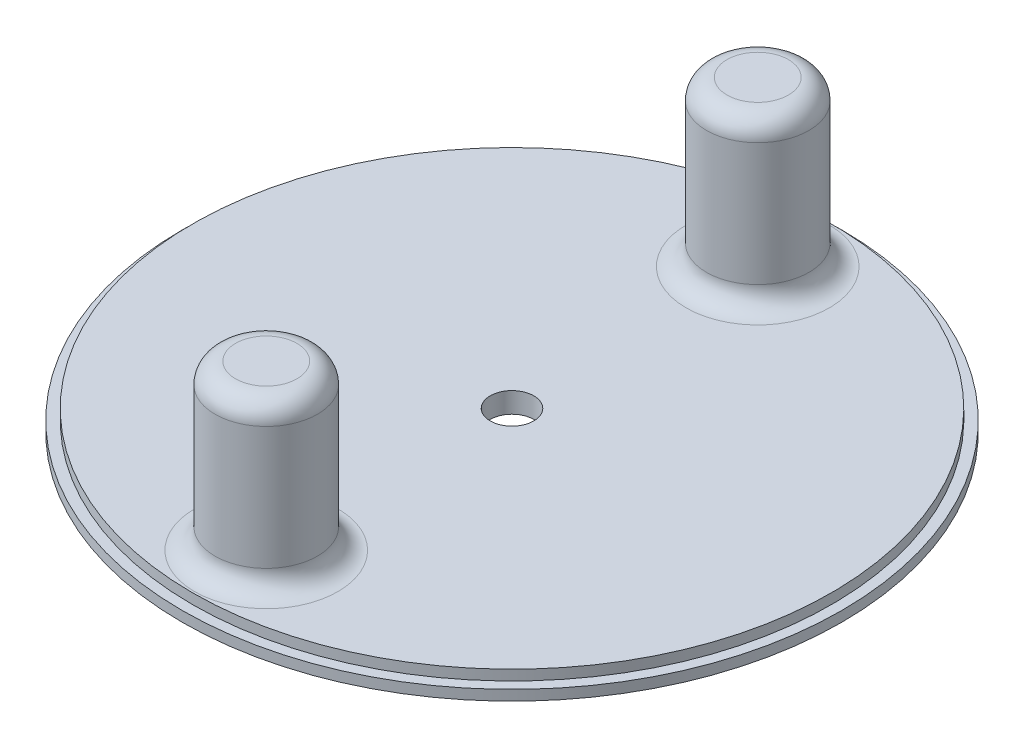
from build123d import *

# Parameters (mm, degrees)
SKETCH1_R                   = 51.1175
BOSS_EXTRUDE1_DEPTH         = 1.5875
SKETCH2_R                   = 49.53
BOSS_EXTRUDE2_DEPTH         = 1.5875
F_1_4_CLEARANCE_HOLE1_D     = 6.7564
F_1_4_CLEARANCE_HOLE1_DEPTH = 25.4
F_1_4_CLEARANCE_HOLE1_TIP   = 2.029827343
SKETCH8_R                   = 7.9375
BOSS_EXTRUDE4_DEPTH         = 25.4
CUT_EXTRUDE2_START          = -1.5875
SKETCH11_R                  = 6.35
CUT_EXTRUDE2_DEPTH          = 77.146200784
FILLET1_R                   = 3.175


with BuildPart() as part:
    # Sketch1 → Boss-Extrude1 (new body)
    with BuildSketch(Plane(origin=(0, 0, 0), x_dir=(1, 0, 0), z_dir=(0, 1, 0))):
        with Locations(Location((0, 0, 0), (0, 0, 270))):
            Circle(SKETCH1_R)
    extrude(amount=BOSS_EXTRUDE1_DEPTH)

    # Sketch2 → Boss-Extrude2 (add)
    with BuildSketch(Plane(origin=(0, 1.5875, 0), x_dir=(1, 0, 0), z_dir=(0, 1, 0))):
        with Locations(Location((0, 0, 0), (0, 0, 270))):
            Circle(SKETCH2_R)
    extrude(amount=BOSS_EXTRUDE2_DEPTH)

    # 1/4 Clearance Hole1
    with Locations(Plane(origin=(0, 3.175, 0), x_dir=(1, 0, 0), z_dir=(0, 1, 0))):
        with Locations((0, 0)):
            Hole(F_1_4_CLEARANCE_HOLE1_D / 2, depth=F_1_4_CLEARANCE_HOLE1_DEPTH)
            with Locations((0, 0, -(F_1_4_CLEARANCE_HOLE1_DEPTH + F_1_4_CLEARANCE_HOLE1_TIP / 2))):  # 118° drill point
                Cone(0, F_1_4_CLEARANCE_HOLE1_D / 2, F_1_4_CLEARANCE_HOLE1_TIP, mode=Mode.SUBTRACT)

    # Sketch8 → Boss-Extrude4 (add)
    with BuildSketch(Plane(origin=(0, 3.175, 0), x_dir=(1, 0, 0), z_dir=(0, 1, 0))):
        with Locations(Location((0, 38.1, 0), (0, 0, 270))):
            Circle(SKETCH8_R)
        with Locations(Location((0, -38.1, 0), (0, 0, 270))):
            Circle(SKETCH8_R)
    extrude(amount=BOSS_EXTRUDE4_DEPTH)

    # Sketch11 → Cut-Extrude2 (cut, through all)
    with BuildSketch(Plane(origin=(0, 28.575, 0), x_dir=(1, 0, 0), z_dir=(0, 1, 0)).offset(CUT_EXTRUDE2_START)):
        with Locations(Location((0, -38.1, 0), (0, 0, 270))):
            Circle(SKETCH11_R)
        with Locations(Location((0, 38.1, 0), (0, 0, 270))):
            Circle(SKETCH11_R)
    extrude(amount=-CUT_EXTRUDE2_DEPTH, mode=Mode.SUBTRACT)

    # Fillet1
    fillet1_edges = [part.edges().sort_by_distance(p)[0] for p in [
        (0, 3.175, -46.0375),
        (0, 28.575, -46.0375),
        (0, 3.175, 30.1625),
        (0, 28.575, 30.1625),
        (0, 26.9875, 31.75),
        (0, 26.9875, -44.45),
    ]]
    fillet(fillet1_edges, radius=FILLET1_R)


solid = part.part
